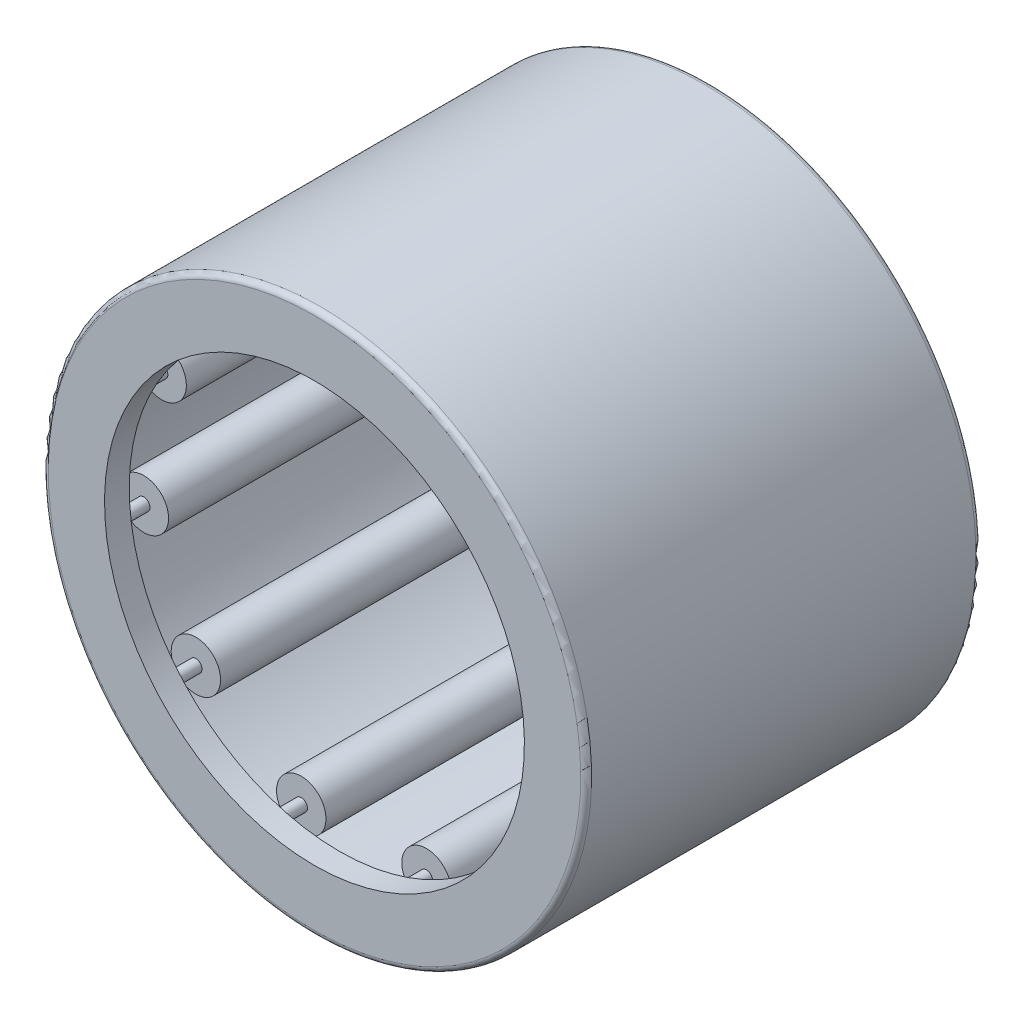
from build123d import *

# Parameters (mm, degrees)
SKETCH2_W         = 9.525
SKETCH2_H         = 0.5953125
SKETCH3_W         = 11.1125
SKETCH3_H         = 0.1984375
CIRPATTERN1_COUNT = 11
CIRPATTERN1_ANGLE = 327.272727273
FILLET1_R         = 0.174625


with BuildPart() as part:
    # Sketch1 → Revolve1 (revolve)
    with BuildSketch(Plane(origin=(0, 0, 0), x_dir=(0, 0, -1), z_dir=(1, 0, 0)), mode=Mode.PRIVATE) as revolve1_sk:
        Polygon((-6.35, 8.73125), (6.35, 8.73125), (6.35, 6.746875), (5.55625, 6.746875), (5.55625, 7.9375), (-5.55625, 7.9375), (-5.55625, 6.746875), (-6.35, 6.746875), align=None)
    revolve(revolve1_sk.sketch.rotate(Axis((0, 0, 6.35), (0, 0, -1)), 180), axis=Axis((0, 0, 6.35), (0, 0, -1)))

    # Fillet1
    fillet1_edges = [part.edges().sort_by_distance(p)[0] for p in [
        (0, 8.73125, 6.35),
        (0, 8.73125, -6.35),
    ]]
    fillet(fillet1_edges, radius=FILLET1_R)


with BuildPart() as body_2:
    # Sketch2 → Revolve2 (revolve)
    with BuildSketch(Plane(origin=(0, 0, 0), x_dir=(0, 0, -1), z_dir=(1, 0, 0)), mode=Mode.PRIVATE) as revolve2_sk:
        with Locations((0, 7.63984375)):
            Rectangle(SKETCH2_W, SKETCH2_H)
    revolve(revolve2_sk.sketch.rotate(Axis((0, 7.14375, 4.7625), (0, 0, -1)), 90), axis=Axis((0, 7.14375, 4.7625), (0, 0, -1)))


with BuildPart() as body_3:
    # Sketch3 → Revolve3 (revolve)
    with BuildSketch(Plane(origin=(0, 0, 0), x_dir=(0, 0, -1), z_dir=(1, 0, 0)), mode=Mode.PRIVATE) as revolve3_sk:
        with Locations((0, 7.24296875)):
            Rectangle(SKETCH3_W, SKETCH3_H)
    revolve(revolve3_sk.sketch.rotate(Axis((0, 7.14375, 5.55625), (0, 0, -1)), 180), axis=Axis((0, 7.14375, 5.55625), (0, 0, -1)))


with BuildPart() as cirpattern1_1:
    # CirPattern1: pattern copy
    add(body_2.part.rotate(Axis((0, 0, -6.35), (0, 0, 1)), 1 * CIRPATTERN1_ANGLE / (CIRPATTERN1_COUNT - 1)))


with BuildPart() as cirpattern1_2:
    # CirPattern1: pattern copy
    add(body_2.part.rotate(Axis((0, 0, -6.35), (0, 0, 1)), 2 * CIRPATTERN1_ANGLE / (CIRPATTERN1_COUNT - 1)))


with BuildPart() as cirpattern1_3:
    # CirPattern1: pattern copy
    add(body_2.part.rotate(Axis((0, 0, -6.35), (0, 0, 1)), 3 * CIRPATTERN1_ANGLE / (CIRPATTERN1_COUNT - 1)))


with BuildPart() as cirpattern1_4:
    # CirPattern1: pattern copy
    add(body_2.part.rotate(Axis((0, 0, -6.35), (0, 0, 1)), 4 * CIRPATTERN1_ANGLE / (CIRPATTERN1_COUNT - 1)))


with BuildPart() as cirpattern1_5:
    # CirPattern1: pattern copy
    add(body_2.part.rotate(Axis((0, 0, -6.35), (0, 0, 1)), 5 * CIRPATTERN1_ANGLE / (CIRPATTERN1_COUNT - 1)))


with BuildPart() as cirpattern1_6:
    # CirPattern1: pattern copy
    add(body_2.part.rotate(Axis((0, 0, -6.35), (0, 0, 1)), 6 * CIRPATTERN1_ANGLE / (CIRPATTERN1_COUNT - 1)))


with BuildPart() as cirpattern1_7:
    # CirPattern1: pattern copy
    add(body_2.part.rotate(Axis((0, 0, -6.35), (0, 0, 1)), 7 * CIRPATTERN1_ANGLE / (CIRPATTERN1_COUNT - 1)))


with BuildPart() as cirpattern1_8:
    # CirPattern1: pattern copy
    add(body_2.part.rotate(Axis((0, 0, -6.35), (0, 0, 1)), 8 * CIRPATTERN1_ANGLE / (CIRPATTERN1_COUNT - 1)))


with BuildPart() as cirpattern1_9:
    # CirPattern1: pattern copy
    add(body_2.part.rotate(Axis((0, 0, -6.35), (0, 0, 1)), 9 * CIRPATTERN1_ANGLE / (CIRPATTERN1_COUNT - 1)))


with BuildPart() as cirpattern1_10:
    # CirPattern1: pattern copy
    add(body_2.part.rotate(Axis((0, 0, -6.35), (0, 0, 1)), 10 * CIRPATTERN1_ANGLE / (CIRPATTERN1_COUNT - 1)))


with BuildPart() as cirpattern1_11:
    # CirPattern1: pattern copy
    add(body_3.part.rotate(Axis((0, 0, -6.35), (0, 0, 1)), 1 * CIRPATTERN1_ANGLE / (CIRPATTERN1_COUNT - 1)))


with BuildPart() as cirpattern1_12:
    # CirPattern1: pattern copy
    add(body_3.part.rotate(Axis((0, 0, -6.35), (0, 0, 1)), 2 * CIRPATTERN1_ANGLE / (CIRPATTERN1_COUNT - 1)))


with BuildPart() as cirpattern1_13:
    # CirPattern1: pattern copy
    add(body_3.part.rotate(Axis((0, 0, -6.35), (0, 0, 1)), 3 * CIRPATTERN1_ANGLE / (CIRPATTERN1_COUNT - 1)))


with BuildPart() as cirpattern1_14:
    # CirPattern1: pattern copy
    add(body_3.part.rotate(Axis((0, 0, -6.35), (0, 0, 1)), 4 * CIRPATTERN1_ANGLE / (CIRPATTERN1_COUNT - 1)))


with BuildPart() as cirpattern1_15:
    # CirPattern1: pattern copy
    add(body_3.part.rotate(Axis((0, 0, -6.35), (0, 0, 1)), 5 * CIRPATTERN1_ANGLE / (CIRPATTERN1_COUNT - 1)))


with BuildPart() as cirpattern1_16:
    # CirPattern1: pattern copy
    add(body_3.part.rotate(Axis((0, 0, -6.35), (0, 0, 1)), 6 * CIRPATTERN1_ANGLE / (CIRPATTERN1_COUNT - 1)))


with BuildPart() as cirpattern1_17:
    # CirPattern1: pattern copy
    add(body_3.part.rotate(Axis((0, 0, -6.35), (0, 0, 1)), 7 * CIRPATTERN1_ANGLE / (CIRPATTERN1_COUNT - 1)))


with BuildPart() as cirpattern1_18:
    # CirPattern1: pattern copy
    add(body_3.part.rotate(Axis((0, 0, -6.35), (0, 0, 1)), 8 * CIRPATTERN1_ANGLE / (CIRPATTERN1_COUNT - 1)))


with BuildPart() as cirpattern1_19:
    # CirPattern1: pattern copy
    add(body_3.part.rotate(Axis((0, 0, -6.35), (0, 0, 1)), 9 * CIRPATTERN1_ANGLE / (CIRPATTERN1_COUNT - 1)))


with BuildPart() as cirpattern1_20:
    # CirPattern1: pattern copy
    add(body_3.part.rotate(Axis((0, 0, -6.35), (0, 0, 1)), 10 * CIRPATTERN1_ANGLE / (CIRPATTERN1_COUNT - 1)))


solid = Compound([part.part, body_2.part, body_3.part, cirpattern1_1.part, cirpattern1_2.part, cirpattern1_3.part, cirpattern1_4.part, cirpattern1_5.part, cirpattern1_6.part, cirpattern1_7.part, cirpattern1_8.part, cirpattern1_9.part, cirpattern1_10.part, cirpattern1_11.part, cirpattern1_12.part, cirpattern1_13.part, cirpattern1_14.part, cirpattern1_15.part, cirpattern1_16.part, cirpattern1_17.part, cirpattern1_18.part, cirpattern1_19.part, cirpattern1_20.part])
